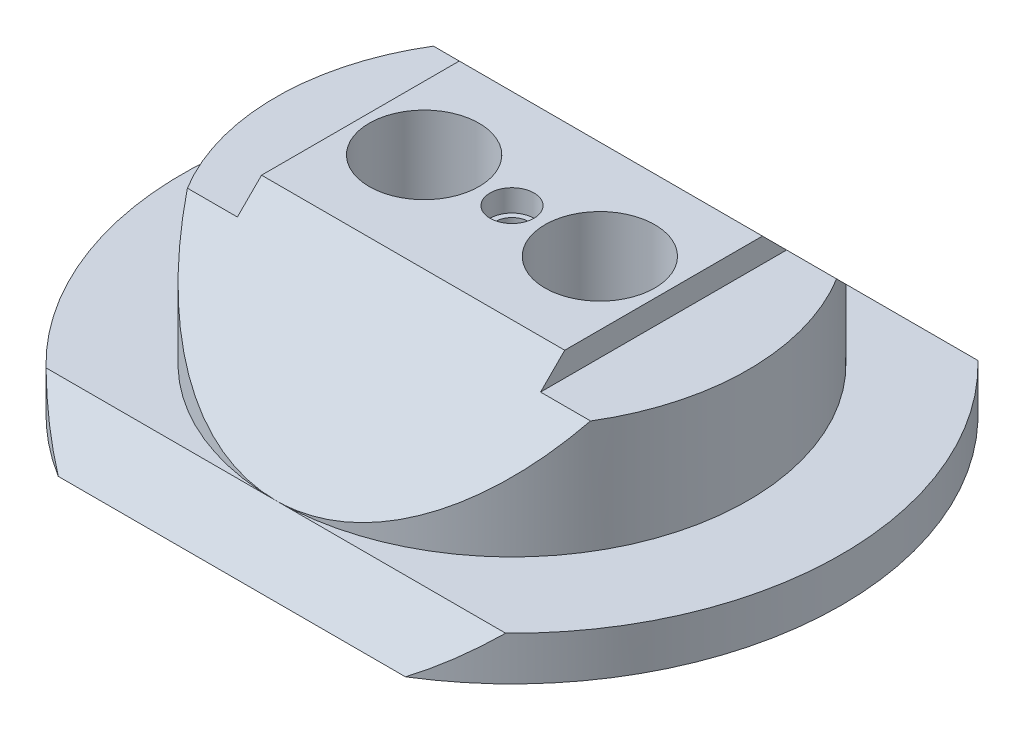
from build123d import *
from build123d.topology import SkipClean

# Parameters (mm, degrees)
SKETCH1_R                            = 30
BOSS_EXTRUDE1_DEPTH                  = 4
BOSS_EXTRUDE2_REACH                  = 44.615
BOSS_EXTRUDE2_END_RADIUS             = 30
BOSS_EXTRUDE2_DIRECTION_2_REACH      = 44.615
BOSS_EXTRUDE2_DIRECTION_2_END_RADIUS = 30
SKETCH3_OUTSIDE_W                    = 78.092
SKETCH3_OUTSIDE_H                    = 69.092
SKETCH3_OUTSIDE_R                    = 21.5
CUT_EXTRUDE2_DEPTH                   = 12.5
BOSS_EXTRUDE3_DEPTH                  = 18
BOSS_EXTRUDE4_DEPTH                  = 15
BOSS_EXTRUDE5_DEPTH                  = 15
CUT_EXTRUDE3_DEPTH                   = 44.292609069
CUT_EXTRUDE3_DEPTH_BACK              = 44.292609069
SKETCH8_R                            = 2
CUT_EXTRUDE8_DEPTH                   = 48.077064479
CUT_EXTRUDE8_DEPTH_BACK              = 48.077064479
CUT_EXTRUDE9_DEPTH                   = 59.659818207
CUT_EXTRUDE11_DEPTH                  = 20
CUT_EXTRUDE12_DEPTH                  = 20
CUT_EXTRUDE13_DEPTH                  = 20
CUT_EXTRUDE14_DEPTH                  = 44.292609069
CUT_EXTRUDE14_DEPTH_BACK             = 44.292609069
SKETCH25_W                           = 66.075437062
SKETCH25_H                           = 20.142243048
SKETCH26_R                           = 5
CUT_EXTRUDE15_DEPTH                  = 24
CUT_EXTRUDE17_DEPTH                  = 47.524187258
CUT_EXTRUDE17_DEPTH_BACK             = 47.524187258
SKETCH29_W                           = 7.7
SKETCH29_H                           = 2.2
CUT_EXTRUDE18_DEPTH                  = 47.524187258
CUT_EXTRUDE18_DEPTH_BACK             = 47.524187258
SKETCH31_W                           = 7.7
SKETCH31_H                           = 2.2
SKETCH34_R                           = 1.5
CUT_EXTRUDE21_DEPTH                  = 20
SKETCH35_R                           = 2
CUT_EXTRUDE22_DEPTH                  = 2


with BuildPart() as part:
    # Sketch1 → Boss-Extrude1 (new body)
    with BuildSketch(Plane(origin=(0, 0, 0), x_dir=(1, 0, 0), z_dir=(0, 1, 0))):
        with Locations(Location((0, 0, 0), (0, 0, 270))):
            Circle(SKETCH1_R)
    extrude(amount=BOSS_EXTRUDE1_DEPTH)

    # Boss-Extrude2: up to this cylinder (the profile starts inside it)
    with SkipClean():  # the faces are left unmerged after this step: merging them gives an invalid solid
        boss_extrude2_end = Plane(origin=(0, 9.396175, 0), z_dir=(0, -1, 0)) * Cylinder(BOSS_EXTRUDE2_END_RADIUS, 150.23, mode=Mode.PRIVATE)
        # Sketch2 → Boss-Extrude2 (add, up to the surface)
        with BuildSketch(Plane(origin=(0, 0, 0), x_dir=(0, 0, -1), z_dir=(1, 0, 0)), mode=Mode.PRIVATE) as boss_extrude2_sk1:
            Polygon((0, 4), (21.5, 4), (9, 16.5), (-9, 16.5), (-21.5, 4), align=None)
        boss_extrude2_tool1 = extrude(boss_extrude2_sk1.sketch, amount=BOSS_EXTRUDE2_REACH, mode=Mode.PRIVATE) & boss_extrude2_end
        add(boss_extrude2_tool1.solids().sort_by_distance((0, 9.396175, 0))[0])

    # Boss-Extrude2 direction 2: up to this cylinder (the profile starts inside it)
    with SkipClean():  # the faces are left unmerged after this step: merging them gives an invalid solid
        boss_extrude2_direction_2_end = Plane(origin=(0, 9.396175, 0), z_dir=(0, -1, 0)) * Cylinder(BOSS_EXTRUDE2_DIRECTION_2_END_RADIUS, 150.23, mode=Mode.PRIVATE)
        # Sketch2 → Boss-Extrude2 direction 2 (add, up to the surface)
        with BuildSketch(Plane(origin=(0, 0, 0), x_dir=(0, 0, -1), z_dir=(1, 0, 0)), mode=Mode.PRIVATE) as boss_extrude2_direction_2_sk1:
            Polygon((0, 4), (21.5, 4), (9, 16.5), (-9, 16.5), (-21.5, 4), align=None)
        boss_extrude2_direction_2_tool1 = extrude(boss_extrude2_direction_2_sk1.sketch, amount=-BOSS_EXTRUDE2_DIRECTION_2_REACH, mode=Mode.PRIVATE) & boss_extrude2_direction_2_end
        add(boss_extrude2_direction_2_tool1.solids().sort_by_distance((0, 9.396175, 0))[0])

    # SurfaceCut1
    split(bisect_by=Plane(origin=(0, 12.75, -12.75), x_dir=(1, 0, 0), z_dir=(0, 0.7071067811865558, -0.7071067811865392)), keep=Keep.BOTTOM)

    # SurfaceCut2
    split(bisect_by=Plane(origin=(0, 12.75, 12.75), x_dir=(1, 0, 0), z_dir=(0, 0.7071067811865509, 0.7071067811865442)), keep=Keep.BOTTOM)

    # Sketch3 outside → Cut-Extrude2 (cut)
    with BuildSketch(Plane(origin=(0, 4, 0), x_dir=(1, 0, 0), z_dir=(0, 1, 0))):
        Rectangle(SKETCH3_OUTSIDE_W, SKETCH3_OUTSIDE_H)
        Circle(SKETCH3_OUTSIDE_R, mode=Mode.SUBTRACT)
    extrude(amount=CUT_EXTRUDE2_DEPTH, mode=Mode.SUBTRACT)

    # Sketch5 → Boss-Extrude3 (add)
    with BuildSketch(Plane(origin=(0, 0, 0), x_dir=(-1, 0, 0), z_dir=(0, -1, 0))):
        Polygon((0, -6), (-17.5, -6), (-17.5, 6), (17.5, 6), (17.5, -6), align=None)
    extrude(amount=BOSS_EXTRUDE3_DEPTH)

    # Sketch6 → Boss-Extrude4 (add)
    with BuildSketch(Plane.XZ):
        Polygon((0, 15), (7, 15), (7, 6), (-7, 6), (-7, 15), align=None)
    extrude(amount=BOSS_EXTRUDE4_DEPTH)

    # Sketch7 → Boss-Extrude5 (add)
    with BuildSketch(Plane.XZ):
        Polygon((0, -15), (7, -15), (7, -6), (-7, -6), (-7, -15), align=None)
    extrude(amount=BOSS_EXTRUDE5_DEPTH)

    # Sketch8 → Cut-Extrude3 (cut, two sides: drawn at the far end of the back side and taken through both)
    with BuildSketch(Plane.XY.offset(-CUT_EXTRUDE3_DEPTH_BACK)):
        with Locations((-12.5, -12.5)):
            Circle(SKETCH8_R)
        with Locations((12.5, -12.5)):
            Circle(SKETCH8_R)
    extrude(amount=CUT_EXTRUDE3_DEPTH + CUT_EXTRUDE3_DEPTH_BACK, mode=Mode.SUBTRACT)

    # Sketch16 → Cut-Extrude8 (cut, two sides: drawn at the far end of the back side and taken through both)
    with BuildSketch(Plane.XY.offset(6).offset(-CUT_EXTRUDE8_DEPTH_BACK)):
        Polygon((17.5, -18), (17.5, -14.5), (14, -18), align=None)
        Polygon((-17.5, -18), (-14, -18), (-17.5, -14.5), align=None)
    extrude(amount=CUT_EXTRUDE8_DEPTH + CUT_EXTRUDE8_DEPTH_BACK, mode=Mode.SUBTRACT)

    # Sketch17 → Cut-Extrude9 (cut, through all)
    with BuildSketch(Plane(origin=(10.365975269, -9.674910251, -8.062425209), x_dir=(-0.3613483622370374, 0.337258471421235, -0.8693009171531012), z_dir=(0.6355070151731325, -0.5931398808282571, -0.49428323402354774))):
        Polygon((-2.372510104, -6.189601271), (7.980636686, -0.706686759), (7.980636686, -10.965829024), align=None)
    extrude(amount=CUT_EXTRUDE9_DEPTH, mode=Mode.SUBTRACT)

    # Sketch19 → Cut-Extrude11 (cut)
    with BuildSketch(Plane(origin=(-10.365975269, -9.674910251, -8.062425209), x_dir=(0.3613483622370374, 0.33725847142123494, -0.8693009171531012), z_dir=(0.6355070151731324, 0.5931398808282571, 0.4942832340235476))):
        Polygon((-2.372510104, -6.189601271), (7.980636686, -10.965829024), (7.980636686, -0.706686759), align=None)
    extrude(amount=-CUT_EXTRUDE11_DEPTH, mode=Mode.SUBTRACT)

    # Sketch20 → Cut-Extrude12 (cut)
    with BuildSketch(Plane(origin=(-10.365975269, -9.674910251, 8.062425209), x_dir=(-0.3613483622370374, -0.3372584714212349, -0.8693009171531013), z_dir=(0.6355070151731326, 0.593139880828257, -0.49428323402354757))):
        Polygon((2.372510104, -6.189601271), (-7.980636686, -0.706686759), (-7.980636686, -10.965829024), align=None)
    extrude(amount=-CUT_EXTRUDE12_DEPTH, mode=Mode.SUBTRACT)

    # Sketch21 → Cut-Extrude13 (cut)
    with BuildSketch(Plane(origin=(10.365975269, -9.674910251, 8.062425209), x_dir=(-0.3613483622370374, 0.3372584714212349, 0.8693009171531013), z_dir=(-0.6355070151731326, 0.593139880828257, -0.49428323402354757))):
        Polygon((-2.372510104, -6.189601271), (7.980636686, -0.706686759), (7.980636686, -10.965829024), align=None)
    extrude(amount=-CUT_EXTRUDE13_DEPTH, mode=Mode.SUBTRACT)

    # Sketch25 → Cut-Extrude14 (cut, two sides: drawn at the far end of the back side and taken through both)
    with BuildSketch(Plane.XY.offset(-CUT_EXTRUDE14_DEPTH_BACK)):
        with Locations((0, -10.071121524)):
            Rectangle(SKETCH25_W, SKETCH25_H)
    extrude(amount=CUT_EXTRUDE14_DEPTH + CUT_EXTRUDE14_DEPTH_BACK, mode=Mode.SUBTRACT)

    # Sketch26 → Cut-Extrude15 (cut)
    with BuildSketch(Plane(origin=(0, 16.5, 0), x_dir=(1, 0, 0), z_dir=(0, 1, 0))):
        with Locations(Location((-8, 0, 0), (0, 0, 270))):
            Circle(SKETCH26_R)
        with Locations(Location((8, 0, 0), (0, 0, 270))):
            Circle(SKETCH26_R)
    extrude(amount=-CUT_EXTRUDE15_DEPTH, mode=Mode.SUBTRACT)

    # Sketch29 → Cut-Extrude17 (cut, two sides: drawn at the far end of the back side and taken through both)
    with BuildSketch(Plane.XY.offset(6).offset(-CUT_EXTRUDE17_DEPTH_BACK)):
        with Locations((17.65, 15.4)):
            Rectangle(SKETCH29_W, SKETCH29_H)
    extrude(amount=CUT_EXTRUDE17_DEPTH + CUT_EXTRUDE17_DEPTH_BACK, mode=Mode.SUBTRACT)

    # Sketch31 → Cut-Extrude18 (cut, two sides: drawn at the far end of the back side and taken through both)
    with BuildSketch(Plane.XY.offset(6).offset(-CUT_EXTRUDE18_DEPTH_BACK)):
        with Locations((-17.65, 15.4)):
            Rectangle(SKETCH31_W, SKETCH31_H)
    extrude(amount=CUT_EXTRUDE18_DEPTH + CUT_EXTRUDE18_DEPTH_BACK, mode=Mode.SUBTRACT)

    # Sketch34 → Cut-Extrude21 (cut)
    with BuildSketch(Plane.XZ):
        with Locations(Location((0, 0, 0), (0, 0, 270))):
            Circle(SKETCH34_R)
    extrude(amount=-CUT_EXTRUDE21_DEPTH, mode=Mode.SUBTRACT)

    # Sketch35 → Cut-Extrude22 (cut)
    with BuildSketch(Plane(origin=(0, 16.5, 0), x_dir=(1, 0, 0), z_dir=(0, 1, 0))):
        with Locations(Location((0, 0, 0), (0, 0, 270))):
            Circle(SKETCH35_R)
    extrude(amount=-CUT_EXTRUDE22_DEPTH, mode=Mode.SUBTRACT)


solid = part.part
